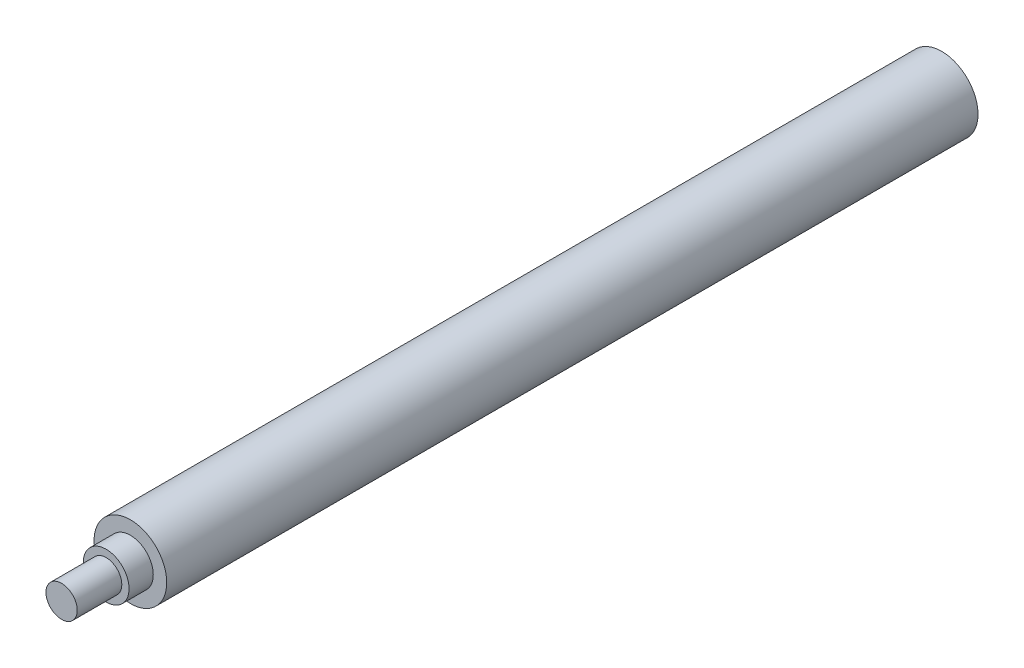
from build123d import *


with BuildPart() as part:
    # Sketch1 → Revolve1 (revolve)
    with BuildSketch(Plane(origin=(0, 0, 0), x_dir=(1, 0, 0), z_dir=(0, 1, 0))):
        Polygon((4.7625, 104.775), (0, 104.775), (0, -10.6045), (2.05, -10.6045), (2.05, -4.7625), (3, -4.7625), (3, -1.5875), (4.7625, -1.5875), align=None)
    revolve(axis=Axis((0, 0, 10.6045), (0, 0, -1)))


solid = part.part
